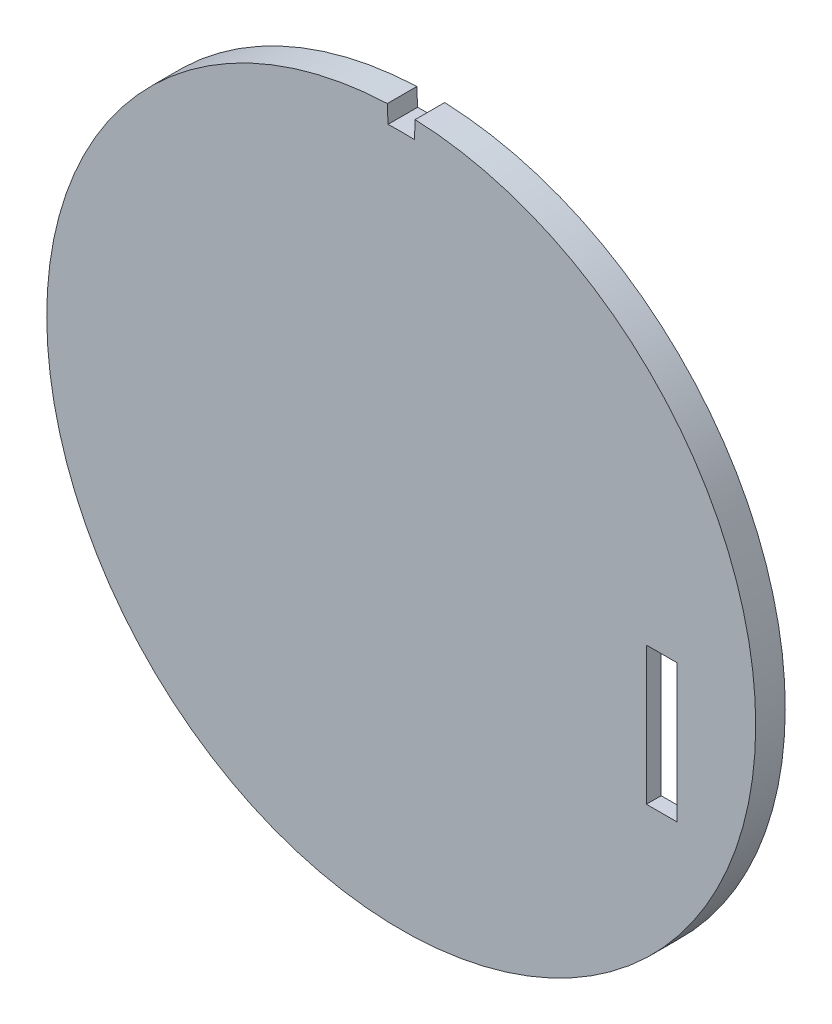
from build123d import *

# Parameters (mm, degrees)
BOSS_EXTRUDE3_DEPTH = 3
BOSS_EXTRUDE4_DEPTH = 1.5


with BuildPart() as part:
    # Sketch1 → Boss-Extrude3 (new body)
    with BuildSketch(Plane.XY):
        with BuildLine():
            ThreePointArc((1.342685699, 34.173633039), (0, 34.2), (-1.342685699, 34.173633039))
            Line((-1.342685699, 34.173633039), (-1.413353367, 35.972245305))
            ThreePointArc((-1.413353367, 35.972245305), (0, -36), (1.413353367, 35.972245305))
            Line((1.413353367, 35.972245305), (1.342685699, 34.173633039))
        make_face()
        Polygon((21.5, -23.5), (-21.5, -23.5), (-28, -17), (-28, 4.5), (28, 4.5), (28, -17), align=None, mode=Mode.SUBTRACT)
    extrude(amount=-BOSS_EXTRUDE3_DEPTH)

    # Sketch1<9> → Boss-Extrude4 (add)
    with BuildSketch(Plane.XY):
        Polygon((28, 4.5), (-28, 4.5), (-28, -17), (-21.5, -23.5), (21.5, -23.5), (28, -17), (28, -12.5), (24.9, -12.5), (24.9, 1.5), (28, 1.5), align=None)
    extrude(amount=-BOSS_EXTRUDE4_DEPTH)


solid = part.part
